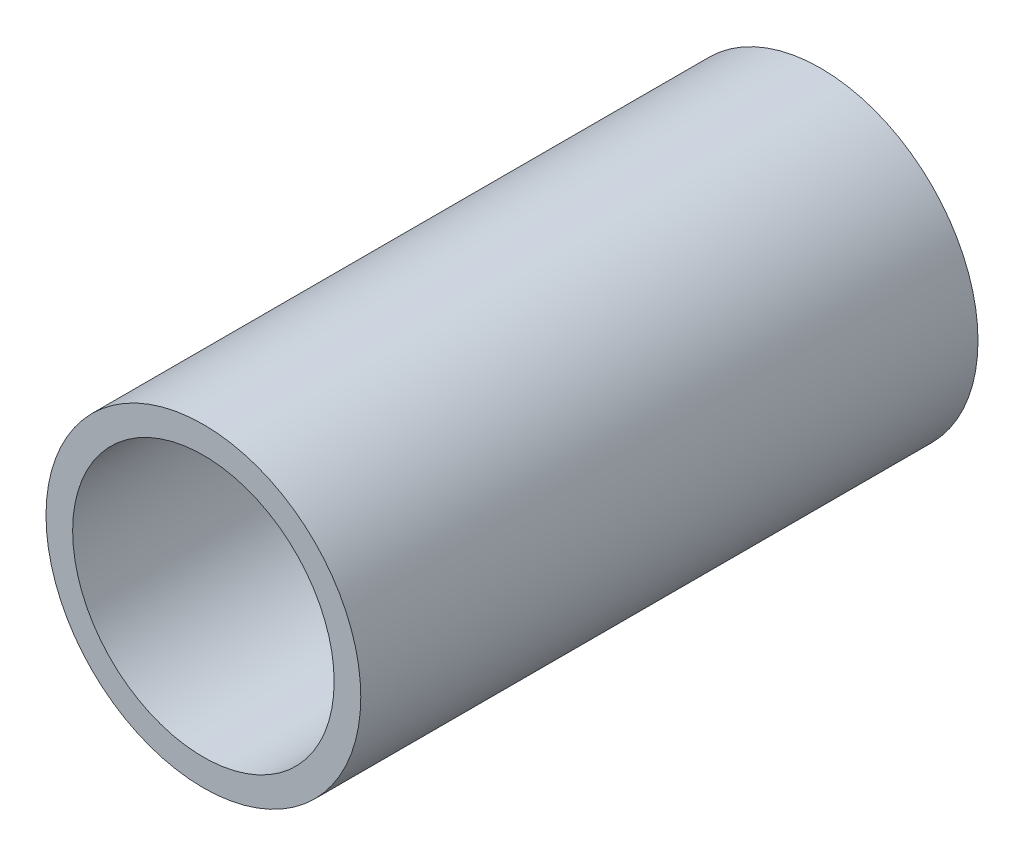
from build123d import *

# Parameters (mm, degrees)
SKETCH1_R           = 12.5
BOSS_EXTRUDE1_DEPTH = 49.02
SKETCH2_R           = 10.385
CUT_EXTRUDE1_DEPTH  = 53.110079639


with BuildPart() as part:
    # Sketch1 → Boss-Extrude1 (new body)
    with BuildSketch(Plane.XY):
        Circle(SKETCH1_R)
    extrude(amount=BOSS_EXTRUDE1_DEPTH)

    # Sketch2 → Cut-Extrude1 (cut, through all)
    with BuildSketch(Plane(origin=(0, 0, 0), x_dir=(-1, 0, 0), z_dir=(0, 0, -1))):
        Circle(SKETCH2_R)
    extrude(amount=-CUT_EXTRUDE1_DEPTH, mode=Mode.SUBTRACT)


solid = part.part
